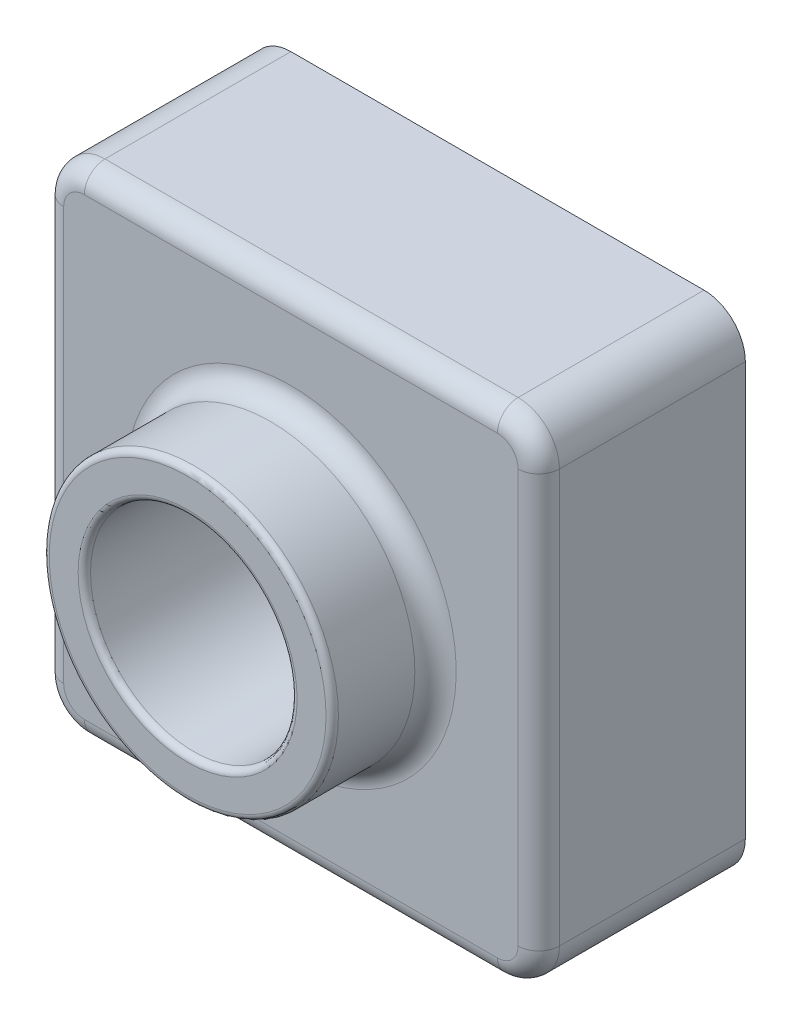
from build123d import *

# Parameters (mm, degrees)
SKETCH1_W           = 120
SKETCH1_H           = 120
BOSS_EXTRUDE1_DEPTH = 50
SKETCH2_R           = 35
BOSS_EXTRUDE2_DEPTH = 25
SKETCH3_R           = 25
CUT_EXTRUDE1_DEPTH  = 186.539753153
FILLET1_R           = 10
FILLET2_R           = 1.5
FILLET3_R           = 5
SHELL1_T            = -2


with BuildPart() as part:
    # Sketch1 → Boss-Extrude1 (new body)
    with BuildSketch(Plane.XY):
        with Locations((60, 60)):
            Rectangle(SKETCH1_W, SKETCH1_H)
    extrude(amount=BOSS_EXTRUDE1_DEPTH)

    # Sketch2 → Boss-Extrude2 (add)
    with BuildSketch(Plane.XY.offset(50)):
        with Locations((60, 60)):
            Circle(SKETCH2_R)
    extrude(amount=BOSS_EXTRUDE2_DEPTH)

    # Sketch3 → Cut-Extrude1 (cut, through all)
    with BuildSketch(Plane.XY.offset(75)):
        with Locations((60, 60)):
            Circle(SKETCH3_R)
    extrude(amount=-CUT_EXTRUDE1_DEPTH, mode=Mode.SUBTRACT)

    # Fillet1
    fillet1_edges = [part.edges().sort_by_distance(p)[0] for p in [
        (0, 0, 25),
        (0, 120, 25),
        (120, 120, 25),
        (120, 0, 25),
    ]]
    fillet(fillet1_edges, radius=FILLET1_R)

    # Fillet2
    fillet2_edges = [part.edges().sort_by_distance(p)[0] for p in [
        (25, 60, 75),
        (35, 60, 75),
    ]]
    fillet(fillet2_edges, radius=FILLET2_R)

    # Fillet3
    fillet3_edges = [part.edges().sort_by_distance(p)[0] for p in [
        (25, 60, 50),
        (60, 0, 50),
        (0, 60, 50),
        (120, 60, 50),
        (60, 120, 50),
        (117.071067812, 2.928932188, 50),
        (2.928932188, 117.071067812, 50),
        (117.071067812, 117.071067812, 50),
        (2.928932188, 2.928932188, 50),
    ]]
    fillet(fillet3_edges, radius=FILLET3_R)

    # Shell1
    shell1_openings = [part.faces().sort_by_distance(p)[0] for p in [
        (1.697056275, 60, 0),
    ]]
    offset(amount=SHELL1_T, openings=shell1_openings, kind=Kind.INTERSECTION)


solid = part.part
